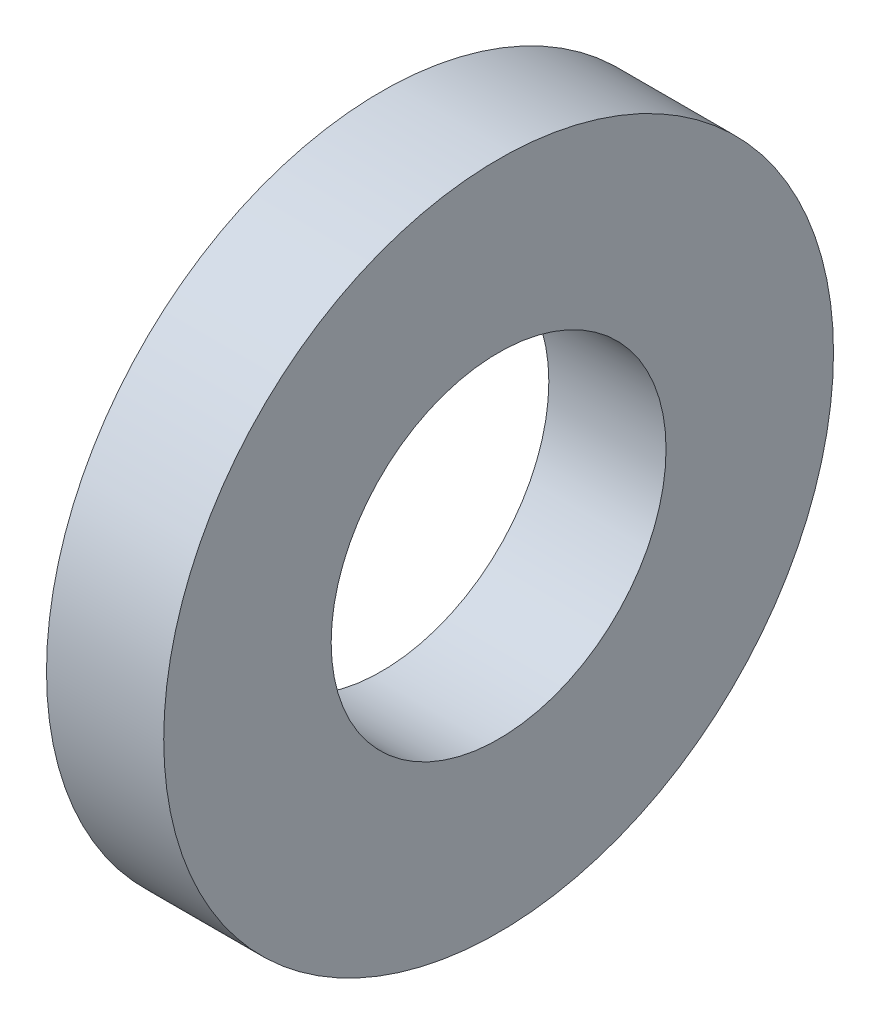
from build123d import *

# Parameters (mm, degrees)
SKETCH1_R           = 10
SKETCH1_R_2         = 5
BOSS_EXTRUDE1_DEPTH = 3.5


with BuildPart() as part:
    # Sketch1 → Boss-Extrude1 (new body)
    with BuildSketch(Plane(origin=(0, 0, 0), x_dir=(0, 0, -1), z_dir=(1, 0, 0))):
        Circle(SKETCH1_R)
        Circle(SKETCH1_R_2, mode=Mode.SUBTRACT)
    extrude(amount=BOSS_EXTRUDE1_DEPTH)


solid = part.part
